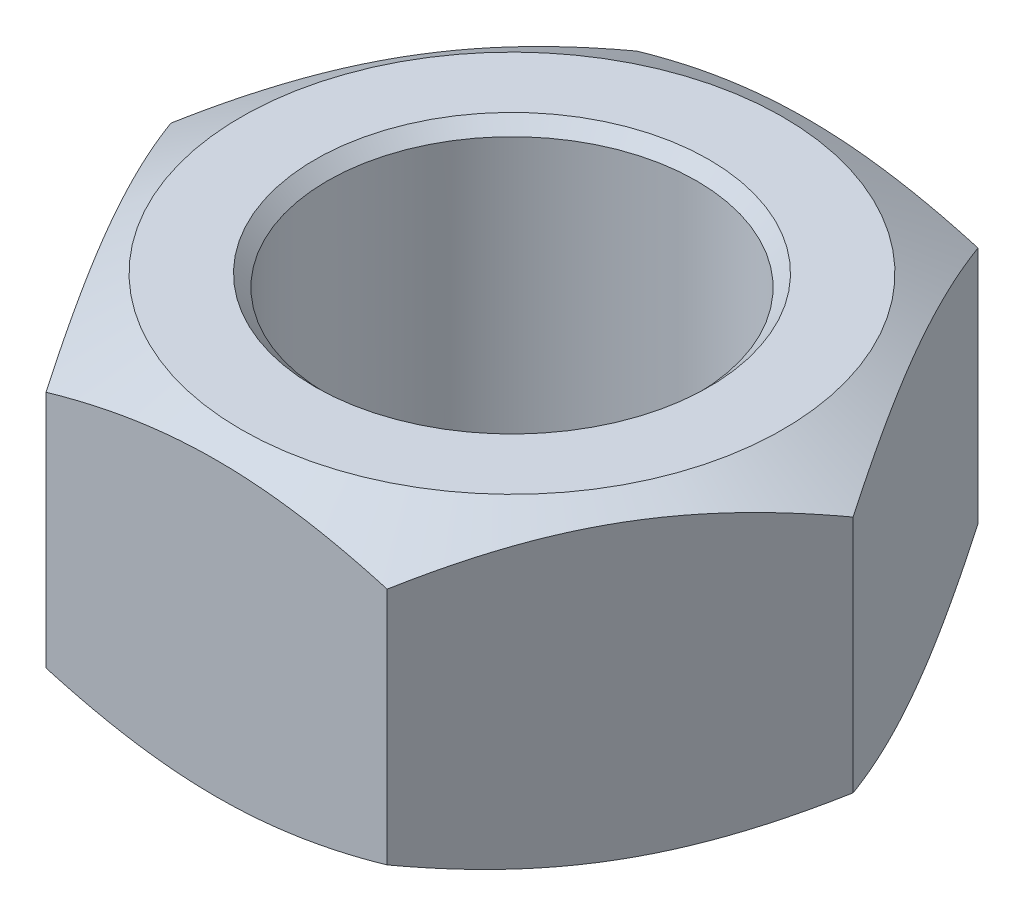
from build123d import *

# Parameters (mm, degrees)
EXTRUDE_1_DEPTH     = 13
SKETCH_5_R          = 7.5
CUT_EXTRUDE_1_DEPTH = 23.472205054
CHAMFER_1_SIZE      = 0.5


with BuildPart() as part:
    # Эскиз1 → Вытянуть1 (new body)
    with BuildSketch(Plane(origin=(0, 0, 0), x_dir=(1, 0, 0), z_dir=(0, 1, 0))):
        Polygon((-6.92820323, 12), (6.92820323, 12), (13.856406461, 0), (6.92820323, -12), (-6.92820323, -12), (-13.856406461, 0), align=None)
    extrude(amount=-EXTRUDE_1_DEPTH)

    # Эскиз5 → Вырез-Вытянуть1 (cut, through all)
    with BuildSketch(Plane.XZ.offset(13)):
        with Locations(Location((0, 0, 0), (0, 0, 270))):
            Circle(SKETCH_5_R)
    extrude(amount=-CUT_EXTRUDE_1_DEPTH, mode=Mode.SUBTRACT)

    # Эскиз4 → Вырез-Повернуть1 (revolve, cut)
    with BuildSketch(Plane.XY, mode=Mode.PRIVATE) as cut_revolve_1_sk:
        Polygon((-13.856406461, -1.649147039), (-11, 0), (-13.856406461, 0), align=None)
        Polygon((-13.856406461, -11.350852961), (-11, -13), (-13.856406461, -13), align=None)
    revolve(cut_revolve_1_sk.sketch.rotate(Axis((0, 0, 0), (0, -1, 0)), 119.999999992), axis=Axis((0, 0, 0), (0, -1, 0)), mode=Mode.SUBTRACT)

    # Фаска1
    chamfer_1_edges = [part.edges().sort_by_distance(p)[0] for p in [
        (0, 0, 7.5),
        (0, -13, 7.5),
    ]]
    chamfer(chamfer_1_edges, length=CHAMFER_1_SIZE)


solid = part.part
